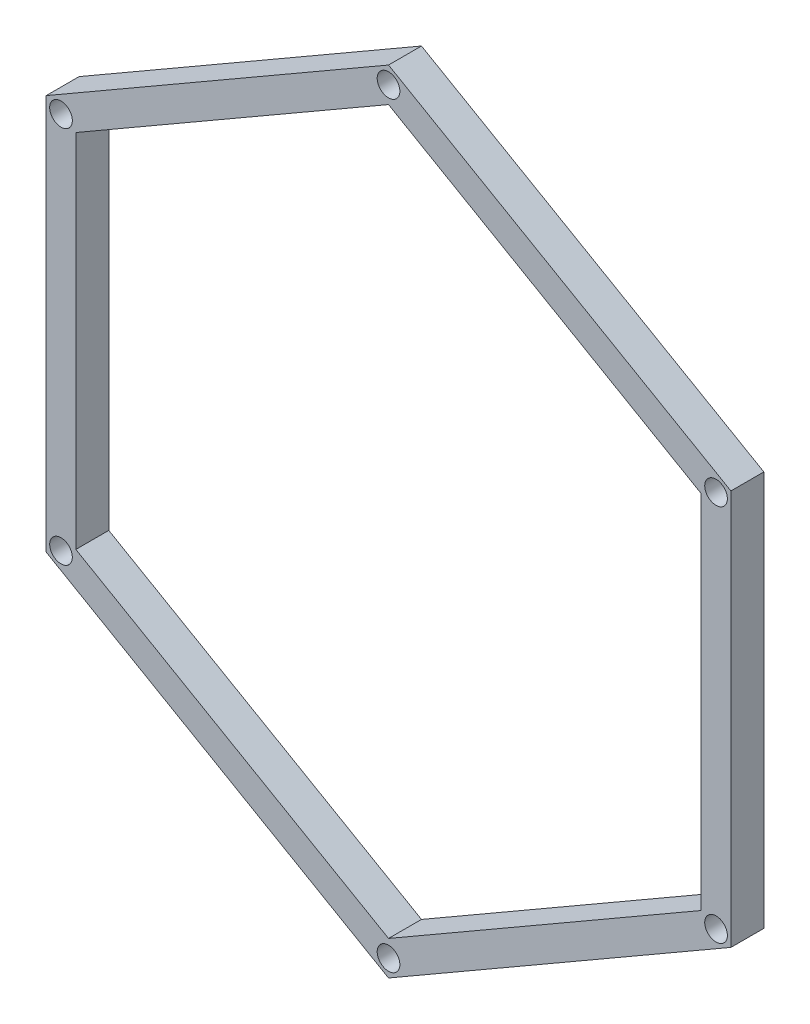
from build123d import *

# Parameters (mm, degrees)
SKETCH1_R           = 1.0922
BOSS_EXTRUDE1_DEPTH = 3.175


with BuildPart() as part:
    # Sketch1 → Boss-Extrude1 (new body)
    with BuildSketch(Plane.XY):
        Polygon((32.995567884, 19.05), (0, 38.1), (-32.995567884, 19.05), (-32.995567884, -19.05), (0, -38.1), (32.995567884, -19.05), align=None)
        with Locations((-31.565759943, 18.2245)):
            Circle(SKETCH1_R, mode=Mode.SUBTRACT)
        with Locations((0, 36.449)):
            Circle(SKETCH1_R, mode=Mode.SUBTRACT)
        with Locations((31.565759943, 18.2245)):
            Circle(SKETCH1_R, mode=Mode.SUBTRACT)
        with Locations((31.565759943, -18.2245)):
            Circle(SKETCH1_R, mode=Mode.SUBTRACT)
        with Locations((0, -36.449)):
            Circle(SKETCH1_R, mode=Mode.SUBTRACT)
        with Locations((-31.565759943, -18.2245)):
            Circle(SKETCH1_R, mode=Mode.SUBTRACT)
        Polygon((30.135952001, 17.399), (0, 34.798), (-30.135952001, 17.399), (-30.135952001, -17.399), (0, -34.798), (30.135952001, -17.399), align=None, mode=Mode.SUBTRACT)
    extrude(amount=BOSS_EXTRUDE1_DEPTH)


solid = part.part
